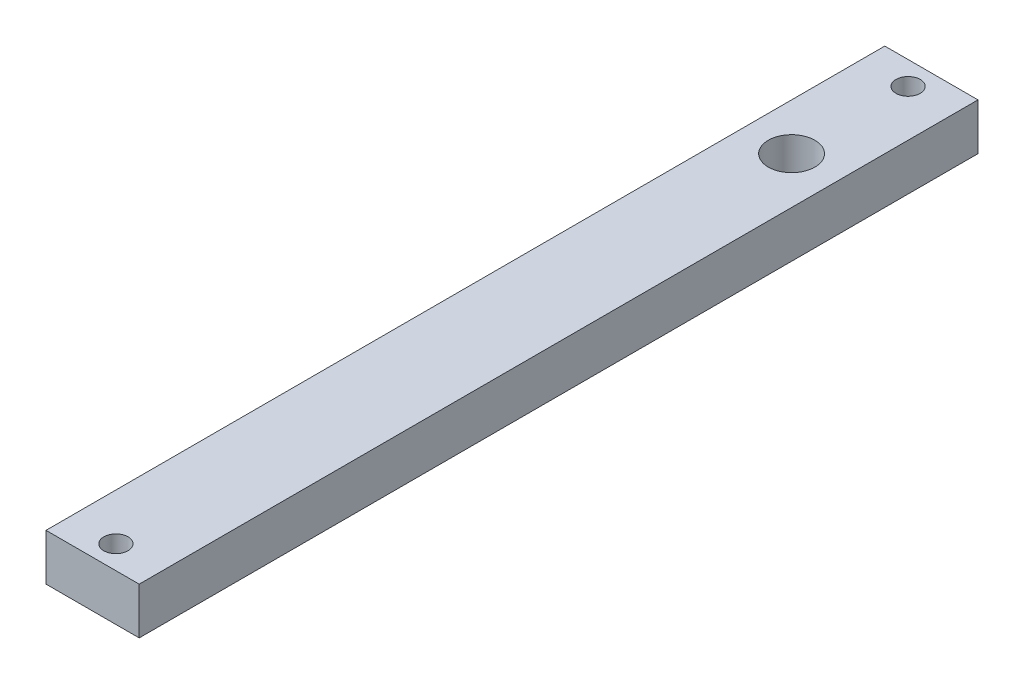
from build123d import *

# Parameters (mm, degrees)
SKETCH1_W           = 12.7
SKETCH1_H           = 101.6
BOSS_EXTRUDE1_DEPTH = 6.35
SKETCH2_W           = 12.7
SKETCH2_H           = 6.35
SKETCH2_R           = 1.651
BOSS_EXTRUDE2_DEPTH = 6.35
SKETCH3_R           = 3.175
CUT_EXTRUDE1_DEPTH  = 58.851253228


with BuildPart() as part:
    # Sketch1 → Boss-Extrude1 (new body)
    with BuildSketch(Plane(origin=(0, 0, 0), x_dir=(1, 0, 0), z_dir=(0, 1, 0))):
        Rectangle(SKETCH1_W, SKETCH1_H)
    extrude(amount=BOSS_EXTRUDE1_DEPTH)

    # Sketch2 → Boss-Extrude2 (add)
    # profile 1 of 2: a face of its own
    with BuildSketch(Plane(origin=(0, 6.35, 0), x_dir=(1, 0, 0), z_dir=(0, 1, 0))):
        with Locations((0, 53.975)):
            Rectangle(SKETCH2_W, SKETCH2_H)
        with Locations(Location((0, 53.975, 0), (0, 0, 270))):
            Circle(SKETCH2_R, mode=Mode.SUBTRACT)
    # profile 2 of 2: a face of its own
    with BuildSketch(Plane(origin=(0, 6.35, 0), x_dir=(1, 0, 0), z_dir=(0, 1, 0))):
        with Locations((0, -53.975)):
            Rectangle(SKETCH2_W, SKETCH2_H)
        with Locations(Location((0, -53.975, 0), (0, 0, 270))):
            Circle(SKETCH2_R, mode=Mode.SUBTRACT)
    extrude(amount=-BOSS_EXTRUDE2_DEPTH)

    # Sketch3 → Cut-Extrude1 (cut, through all)
    with BuildSketch(Plane(origin=(0, 6.35, 0), x_dir=(1, 0, 0), z_dir=(0, 1, 0))):
        with Locations(Location((0, 38.1, 0), (0, 0, 270))):
            Circle(SKETCH3_R)
    extrude(amount=-CUT_EXTRUDE1_DEPTH, mode=Mode.SUBTRACT)


solid = part.part
